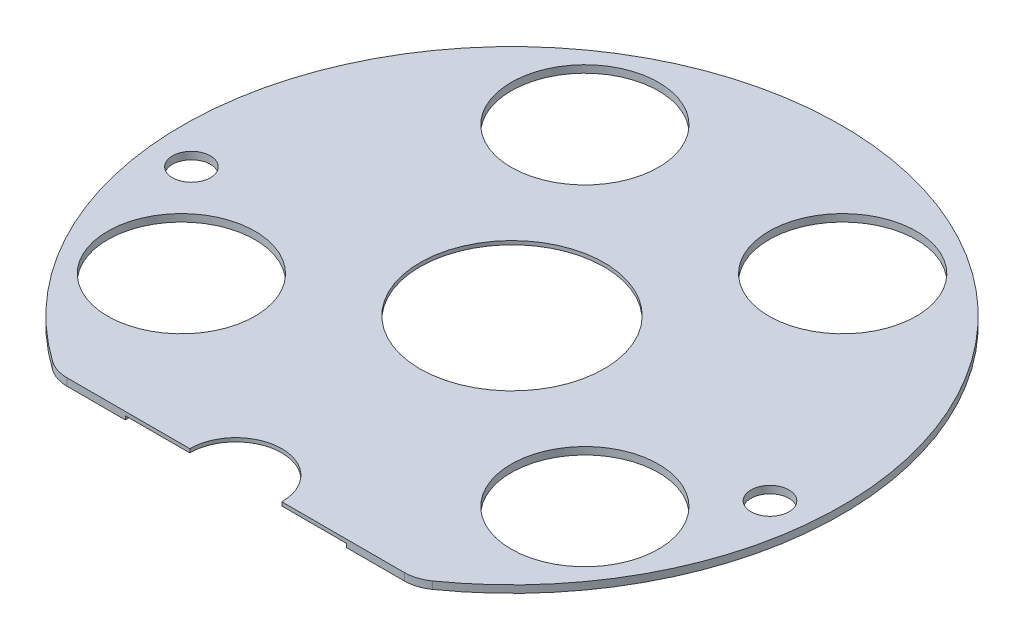
from build123d import *

# Parameters (mm, degrees)
BOSS_EXTRUDE1_DEPTH = 2
SKETCH9_R           = 5.15
CUT_EXTRUDE3_DEPTH  = 127.587914115
VISION_PATTERN_R    = 25
VISION_PATTERN_R_2  = 20
CUT_EXTRUDE4_DEPTH  = 127.587914115
FILLET1_R           = 10
BOSS_EXTRUDE4_DEPTH = 50
SKETCH12_W          = 60
SKETCH12_H          = 105
CUT_EXTRUDE5_DEPTH  = 1
SKETCH16_R          = 12.5
CUT_EXTRUDE9_DEPTH  = 20
SKETCH17_R          = 0.75
BOSS_EXTRUDE3_DEPTH = 0.425
FILLET2_R           = 0.4


with BuildPart() as part:
    # Sketch1 → Boss-Extrude1 (new body)
    with BuildSketch(Plane(origin=(0, 0, 0), x_dir=(1, 0, 0), z_dir=(0, 1, 0))):
        with BuildLine():
            Line((-48.839021284, -75), (48.839021284, -75))
            ThreePointArc((48.839021284, -75), (0, 89.5), (-48.839021284, -75))
        make_face()
    extrude(amount=-BOSS_EXTRUDE1_DEPTH)

    # Sketch9 → Cut-Extrude3 (cut, through all)
    with BuildSketch(Plane(origin=(0, 0, 0), x_dir=(1, 0, 0), z_dir=(0, 1, 0))):
        with Locations(Location((78.541209232, -8.501673503, 0), (0, 0, 270))):
            Circle(SKETCH9_R)
        with Locations(Location((-78.541209232, -8.501673503, 0), (0, 0, 270))):
            Circle(SKETCH9_R)
    extrude(amount=-CUT_EXTRUDE3_DEPTH, mode=Mode.SUBTRACT)

    # Vision Pattern → Cut-Extrude4 (cut, through all)
    with BuildSketch(Plane(origin=(0, 0, 0), x_dir=(1, 0, 0), z_dir=(0, 1, 0))):
        with Locations(Location((0, 0, 0), (0, 0, 270))):
            Circle(VISION_PATTERN_R)
        with Locations(Location((54.772255751, -35, 0), (0, 0, 270))):
            Circle(VISION_PATTERN_R_2)
        with Locations(Location((-54.772255751, -35, 0), (0, 0, 270))):
            Circle(VISION_PATTERN_R_2)
        with Locations(Location((35, 54.772255751, 0), (0, 0, 270))):
            Circle(VISION_PATTERN_R_2)
        with Locations(Location((-35, 54.772255751, 0), (0, 0, 270))):
            Circle(VISION_PATTERN_R_2)
    extrude(amount=-CUT_EXTRUDE4_DEPTH, mode=Mode.SUBTRACT)

    # Fillet1
    fillet1_edges = [part.edges().sort_by_distance(p)[0] for p in [
        (48.839021284, -1, 75),
        (-48.839021284, -1, 75),
    ]]
    fillet(fillet1_edges, radius=FILLET1_R)

    # Sketch18 → Boss-Extrude4 (add)
    with BuildSketch(Plane.XY.offset(5)):
        Polygon((63.11284211, -3.45), (66.88715789, -3.45), (66.05, -2), (63.95, -2), align=None)
    boss_extrude4 = extrude(amount=-BOSS_EXTRUDE4_DEPTH)

    # Mirror2: Boss-Extrude4 across plane
    add(boss_extrude4.mirror(Plane(origin=(0, 0, 0), x_dir=(0, 0, 1), z_dir=(1, 0, 0))))

    # Sketch12 → Cut-Extrude5 (cut)
    with BuildSketch(Plane.XZ.offset(2)):
        with Locations((0, 22.5)):
            Rectangle(SKETCH12_W, SKETCH12_H)
    extrude(amount=-CUT_EXTRUDE5_DEPTH, mode=Mode.SUBTRACT)

    # Sketch16 → Cut-Extrude9 (cut)
    with BuildSketch(Plane(origin=(0, 0, 0), x_dir=(1, 0, 0), z_dir=(0, 1, 0))):
        with Locations((0, -75)):
            Circle(SKETCH16_R)
    extrude(amount=-CUT_EXTRUDE9_DEPTH, mode=Mode.SUBTRACT)

    # Sketch17 → Boss-Extrude3 (add)
    with BuildSketch(Plane.XZ.offset(1)):
        with Locations(Location((-20, 72.05, 0), (0, 0, 270))):
            Circle(SKETCH17_R)
    boss_extrude3 = extrude(amount=BOSS_EXTRUDE3_DEPTH)

    # Mirror1: Boss-Extrude3 across plane
    add(boss_extrude3.mirror(Plane(origin=(0, 0, 0), x_dir=(0, 0, 1), z_dir=(1, 0, 0))))

    # Fillet2
    fillet2_edges = [part.edges().sort_by_distance(p)[0] for p in [
        (-20, -1.425, 72.8),
        (20, -1.425, 72.8),
    ]]
    fillet(fillet2_edges, radius=FILLET2_R)


solid = part.part
